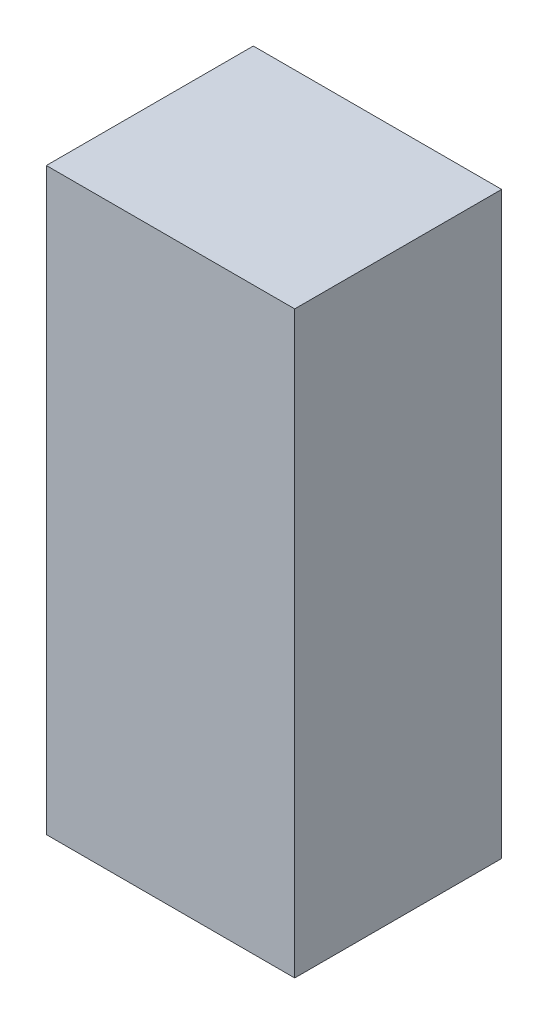
from build123d import *

# Parameters (mm, degrees)
SKETCH1_W           = 12
SKETCH1_H           = 28
BOSS_EXTRUDE1_DEPTH = 10


with BuildPart() as part:
    # Sketch1 → Boss-Extrude1 (new body)
    with BuildSketch(Plane.XY):
        Rectangle(SKETCH1_W, SKETCH1_H)
    extrude(amount=-BOSS_EXTRUDE1_DEPTH)


solid = part.part
